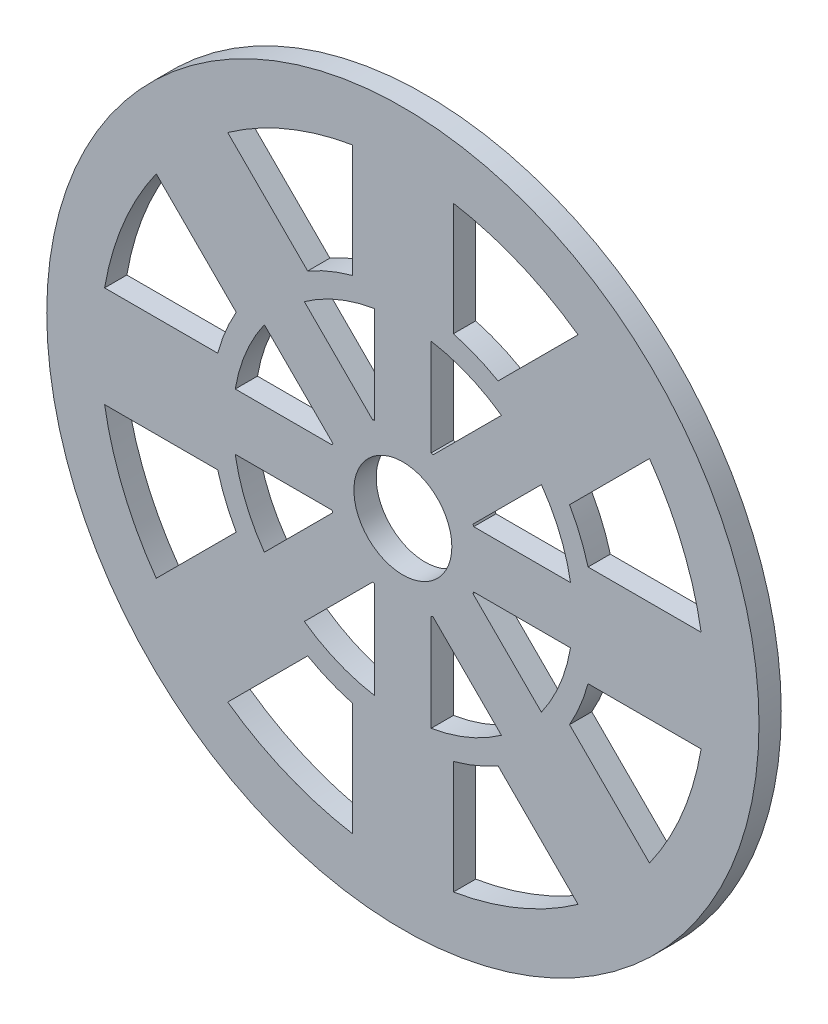
from build123d import *

# Parameters (mm, degrees)
SKETCH1_R           = 80
SKETCH1_R_2         = 11
BOSS_EXTRUDE1_DEPTH = 5
SKETCH1_3_W         = 25.4
SKETCH1_3_H         = 12.7
SKETCH1_3_W_2       = 12.7
SKETCH1_3_H_2       = 25.4
CUT_EXTRUDE2_DEPTH  = 3.175
CUT_EXTRUDE3_DEPTH  = 19
CUT_EXTRUDE4_DEPTH  = 19


with BuildPart() as part:
    # Sketch1 → Boss-Extrude1 (new body)
    with BuildSketch(Plane.XY):
        Circle(SKETCH1_R)
        Circle(SKETCH1_R_2, mode=Mode.SUBTRACT)
    extrude(amount=BOSS_EXTRUDE1_DEPTH)

    # Sketch1<3> → Cut-Extrude2 (cut)
    with BuildSketch(Plane.XY):
        Polygon((33.905770158, -24.925514037), (51.8662824, -42.886026279), (42.886026279, -51.8662824), (24.925514037, -33.905770158), align=None)
        with Locations((54.3, 0)):
            Rectangle(SKETCH1_3_W, SKETCH1_3_H)
        with Locations((0, -54.3)):
            Rectangle(SKETCH1_3_W_2, SKETCH1_3_H_2)
        Polygon((-24.925514037, -33.905770158), (-42.886026279, -51.8662824), (-51.8662824, -42.886026279), (-33.905770158, -24.925514037), align=None)
        with Locations((-54.3, 0)):
            Rectangle(SKETCH1_3_W, SKETCH1_3_H)
        Polygon((-33.905770158, 24.925514037), (-51.8662824, 42.886026279), (-42.886026279, 51.8662824), (-24.925514037, 33.905770158), align=None)
        with Locations((0, 54.3)):
            Rectangle(SKETCH1_3_W_2, SKETCH1_3_H_2)
        Polygon((24.925514037, 33.905770158), (42.886026279, 51.8662824), (51.8662824, 42.886026279), (33.905770158, 24.925514037), align=None)
    extrude(amount=CUT_EXTRUDE2_DEPTH, mode=Mode.SUBTRACT)

    # Sketch2 → Cut-Extrude3 (cut)
    with BuildSketch(Plane(origin=(0, 0, 0), x_dir=(-1, 0, 0), z_dir=(0, 0, -1))):
        with BuildLine():
            ThreePointArc((31.116508001, -22.13625188), (35.280233052, -14.613551014), (37.655387628, -6.35))
            Line((37.655387628, -6.35), (15.911210185, -6.35))
            ThreePointArc((15.911210185, -6.35), (15.827464249, -6.55595035), (15.741052679, -6.760796558))
            Line((15.741052679, -6.760796558), (31.116508001, -22.13625188))
        make_face()
        with BuildLine():
            ThreePointArc((6.35, -37.655387628), (14.613551014, -35.280233052), (22.13625188, -31.116508001))
            Line((22.13625188, -31.116508001), (6.760796558, -15.741052679))
            ThreePointArc((6.760796558, -15.741052679), (6.55595035, -15.827464249), (6.35, -15.911210185))
            Line((6.35, -15.911210185), (6.35, -37.655387628))
        make_face()
        with BuildLine():
            Line((15.911210185, 6.35), (37.655387628, 6.35))
            ThreePointArc((37.655387628, 6.35), (35.280233052, 14.613551014), (31.116508001, 22.13625188))
            Line((31.116508001, 22.13625188), (15.741052679, 6.760796558))
            ThreePointArc((15.741052679, 6.760796558), (15.827464249, 6.55595035), (15.911210185, 6.35))
        make_face()
        with BuildLine():
            ThreePointArc((-22.13625188, -31.116508001), (-14.613551014, -35.280233052), (-6.35, -37.655387628))
            Line((-6.35, -37.655387628), (-6.35, -15.911210185))
            ThreePointArc((-6.35, -15.911210185), (-6.55595035, -15.827464249), (-6.760796558, -15.741052679))
            Line((-6.760796558, -15.741052679), (-22.13625188, -31.116508001))
        make_face()
        with BuildLine():
            Line((6.760796558, 15.741052679), (22.13625188, 31.116508001))
            ThreePointArc((22.13625188, 31.116508001), (14.613551014, 35.280233052), (6.35, 37.655387628))
            Line((6.35, 37.655387628), (6.35, 15.911210185))
            ThreePointArc((6.35, 15.911210185), (6.55595035, 15.827464249), (6.760796558, 15.741052679))
        make_face()
        with BuildLine():
            ThreePointArc((-37.655387628, -6.35), (-35.280233052, -14.613551014), (-31.116508001, -22.13625188))
            Line((-31.116508001, -22.13625188), (-15.741052679, -6.760796558))
            ThreePointArc((-15.741052679, -6.760796558), (-15.827464249, -6.55595035), (-15.911210185, -6.35))
            Line((-15.911210185, -6.35), (-37.655387628, -6.35))
        make_face()
        with BuildLine():
            Line((-6.35, 15.911210185), (-6.35, 37.655387628))
            ThreePointArc((-6.35, 37.655387628), (-14.613551014, 35.280233052), (-22.13625188, 31.116508001))
            Line((-22.13625188, 31.116508001), (-6.760796558, 15.741052679))
            ThreePointArc((-6.760796558, 15.741052679), (-6.55595035, 15.827464249), (-6.35, 15.911210185))
        make_face()
        with BuildLine():
            ThreePointArc((-31.116508001, 22.13625188), (-35.280233052, 14.613551014), (-37.655387628, 6.35))
            Line((-37.655387628, 6.35), (-15.911210185, 6.35))
            ThreePointArc((-15.911210185, 6.35), (-15.827464249, 6.55595035), (-15.741052679, 6.760796558))
            Line((-15.741052679, 6.760796558), (-31.116508001, 22.13625188))
        make_face()
    extrude(amount=-CUT_EXTRUDE3_DEPTH, mode=Mode.SUBTRACT)

    # Sketch3 → Cut-Extrude4 (cut)
    with BuildSketch(Plane(origin=(0, 0, 0), x_dir=(-1, 0, 0), z_dir=(0, 0, -1))):
        with BuildLine():
            Line((39.350492373, -55.401816306), (21.389980131, -37.441304064))
            ThreePointArc((21.389980131, -37.441304064), (16.501523042, -39.838200729), (11.35, -41.6))
            Line((11.35, -41.6), (11.35, -67))
            ThreePointArc((11.35, -67), (26.005085041, -62.781828996), (39.350492373, -55.401816306))
        make_face()
        with BuildLine():
            Line((55.401816306, 39.350492373), (37.441304064, 21.389980131))
            ThreePointArc((37.441304064, 21.389980131), (39.838200729, 16.501523042), (41.6, 11.35))
            Line((41.6, 11.35), (67, 11.35))
            ThreePointArc((67, 11.35), (62.781828996, 26.005085041), (55.401816306, 39.350492373))
        make_face()
        with BuildLine():
            Line((-55.401816306, -39.350492373), (-37.441304064, -21.389980131))
            ThreePointArc((-37.441304064, -21.389980131), (-39.838200729, -16.501523042), (-41.6, -11.35))
            Line((-41.6, -11.35), (-67, -11.35))
            ThreePointArc((-67, -11.35), (-62.781828996, -26.005085041), (-55.401816306, -39.350492373))
        make_face()
        with BuildLine():
            Line((-39.350492373, 55.401816306), (-21.389980131, 37.441304064))
            ThreePointArc((-21.389980131, 37.441304064), (-16.501523042, 39.838200729), (-11.35, 41.6))
            Line((-11.35, 41.6), (-11.35, 67))
            ThreePointArc((-11.35, 67), (-26.005085041, 62.781828996), (-39.350492373, 55.401816306))
        make_face()
        with BuildLine():
            Line((67, -11.35), (41.6, -11.35))
            ThreePointArc((41.6, -11.35), (39.838200729, -16.501523042), (37.441304064, -21.389980131))
            Line((37.441304064, -21.389980131), (55.401816306, -39.350492373))
            ThreePointArc((55.401816306, -39.350492373), (62.781828996, -26.005085041), (67, -11.35))
        make_face()
        with BuildLine():
            Line((-11.35, -67), (-11.35, -41.6))
            ThreePointArc((-11.35, -41.6), (-16.501523042, -39.838200729), (-21.389980131, -37.441304064))
            Line((-21.389980131, -37.441304064), (-39.350492373, -55.401816306))
            ThreePointArc((-39.350492373, -55.401816306), (-26.005085041, -62.781828996), (-11.35, -67))
        make_face()
        with BuildLine():
            Line((-67, 11.35), (-41.6, 11.35))
            ThreePointArc((-41.6, 11.35), (-39.838200729, 16.501523042), (-37.441304064, 21.389980131))
            Line((-37.441304064, 21.389980131), (-55.401816306, 39.350492373))
            ThreePointArc((-55.401816306, 39.350492373), (-62.781828996, 26.005085041), (-67, 11.35))
        make_face()
        with BuildLine():
            Line((11.35, 67), (11.35, 41.6))
            ThreePointArc((11.35, 41.6), (16.501523042, 39.838200729), (21.389980131, 37.441304064))
            Line((21.389980131, 37.441304064), (39.350492373, 55.401816306))
            ThreePointArc((39.350492373, 55.401816306), (26.005085041, 62.781828996), (11.35, 67))
        make_face()
    extrude(amount=-CUT_EXTRUDE4_DEPTH, mode=Mode.SUBTRACT)


solid = part.part
